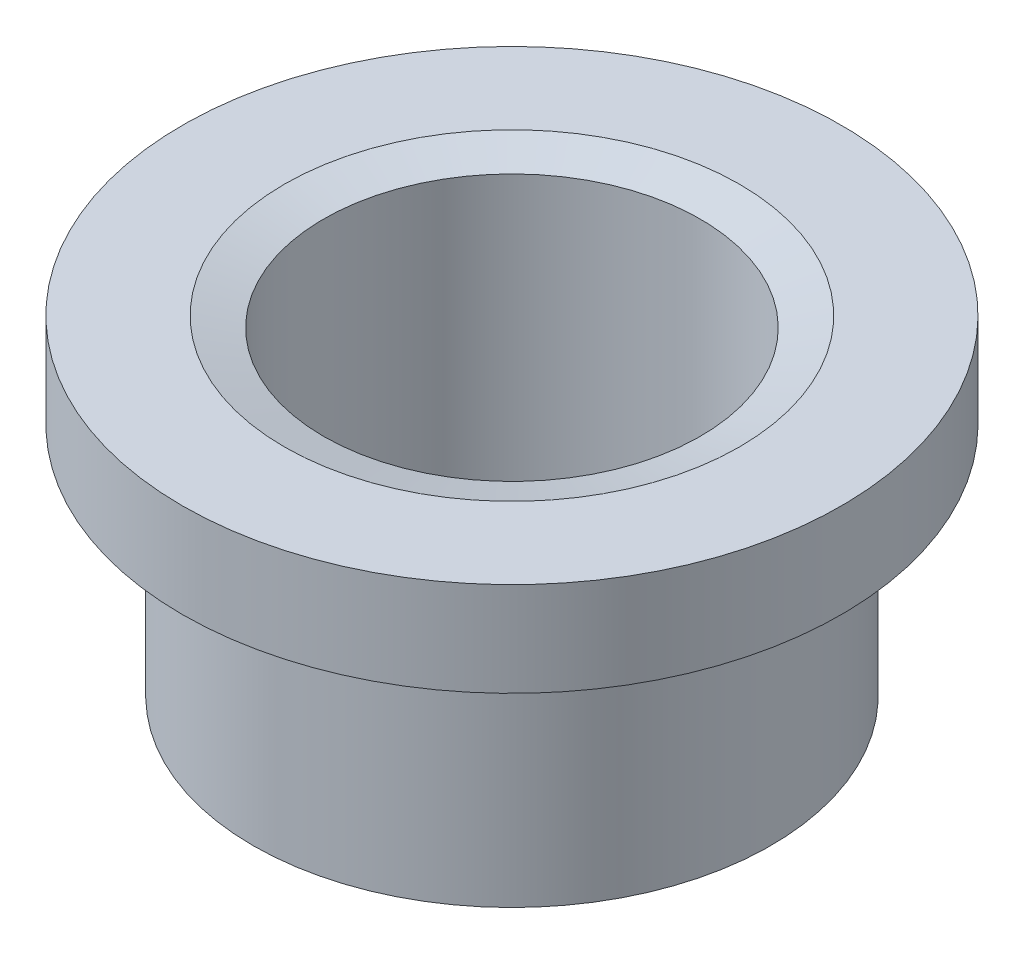
from build123d import *

# Parameters (mm, degrees)
SKETCH1_R           = 16.5
BOSS_EXTRUDE1_DEPTH = 15
SKETCH2_R           = 21
BOSS_EXTRUDE2_DEPTH = 6
SKETCH3_R           = 12
CUT_EXTRUDE1_DEPTH  = 37.373066959
CHAMFER1_SIZE       = 2.5
CHAMFER1_SIZE2      = 0.669872981


with BuildPart() as part:
    # Sketch1 → Boss-Extrude1 (new body)
    with BuildSketch(Plane(origin=(0, 0, 0), x_dir=(1, 0, 0), z_dir=(0, 1, 0))):
        with Locations(Location((0, 0, 0), (0, 0, 270))):
            Circle(SKETCH1_R)
    extrude(amount=BOSS_EXTRUDE1_DEPTH)

    # Sketch2 → Boss-Extrude2 (add)
    with BuildSketch(Plane(origin=(0, 15, 0), x_dir=(1, 0, 0), z_dir=(0, 1, 0))):
        with Locations(Location((0, 0, 0), (0, 0, 270))):
            Circle(SKETCH2_R)
    extrude(amount=BOSS_EXTRUDE2_DEPTH)

    # Sketch3 → Cut-Extrude1 (cut, through all)
    with BuildSketch(Plane(origin=(0, 21, 0), x_dir=(1, 0, 0), z_dir=(0, 1, 0))):
        with Locations(Location((0, 0, 0), (0, 0, 270))):
            Circle(SKETCH3_R)
    extrude(amount=-CUT_EXTRUDE1_DEPTH, mode=Mode.SUBTRACT)

    # Chamfer1
    chamfer1_edges = [part.edges().sort_by_distance(p)[0] for p in [
        (0, 21, -12),
    ]]
    chamfer1_side = [part.faces().sort_by_distance(p)[0] for p in [
        (0, 21, -20.406030304),
    ]]
    chamfer(chamfer1_edges, length=CHAMFER1_SIZE, length2=CHAMFER1_SIZE2, reference=chamfer1_side[0])


solid = part.part
